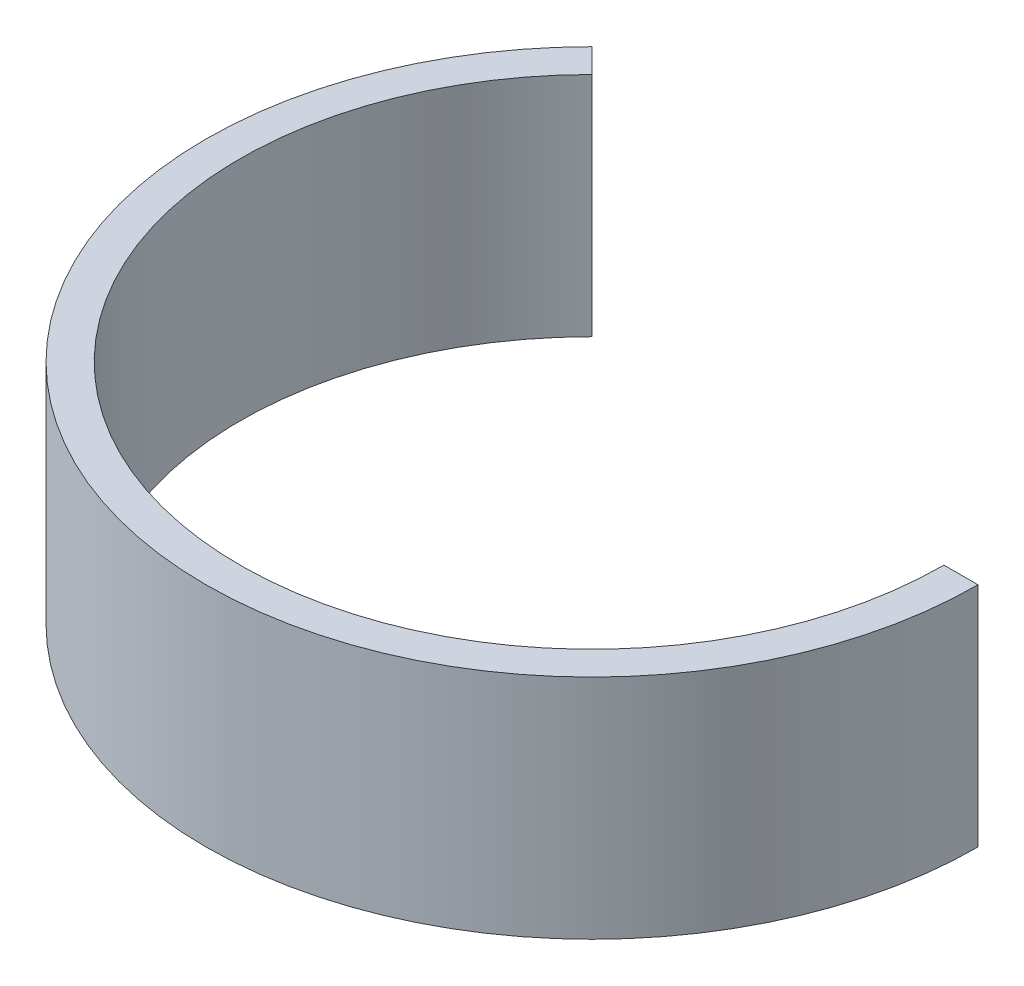
from build123d import *

# Parameters (mm, degrees)
EXTRUDE_1_DEPTH = 10


with BuildPart() as part:
    # 草圖1 → 填料-伸長1 (new body)
    with BuildSketch(Plane(origin=(0, 0, 0), x_dir=(1, 0, 0), z_dir=(0, 1, 0))):
        with BuildLine():
            Line((15.5, 0), (17, 0))
            ThreePointArc((17, 0), (-6.50561835, -15.705952053), (-12.02081528, 12.02081528))
            Line((-12.02081528, 12.02081528), (-10.960155108, 10.960155108))
            ThreePointArc((-10.960155108, 10.960155108), (-5.931593202, -14.320132754), (15.5, 0))
        make_face()
    extrude(amount=EXTRUDE_1_DEPTH)


solid = part.part
